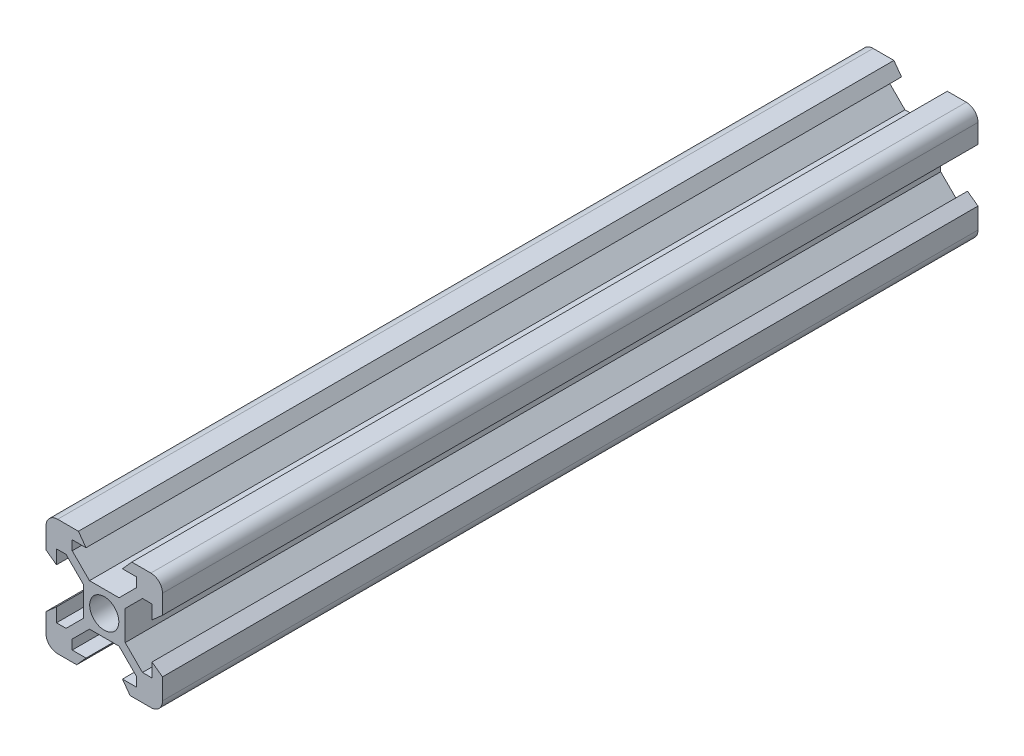
from build123d import *

# Parameters (mm, degrees)
SKETCH1_R           = 2.5
BOSS_EXTRUDE1_DEPTH = 140


with BuildPart() as part:
    # Sketch1 → Boss-Extrude1 (new body)
    with BuildSketch(Plane.XY):
        with BuildLine():
            Line((-4.725542729, -10), (-3.125, -8.2))
            Line((-3.125, -8.2), (-5.5, -8.2))
            Line((-5.5, -8.2), (-5.5, -6.560660172))
            Line((-5.5, -6.560660172), (-2.539339828, -3.6))
            Line((-2.539339828, -3.6), (2.539339828, -3.6))
            Line((2.539339828, -3.6), (5.5, -6.560660172))
            Line((5.5, -6.560660172), (5.5, -8.2))
            Line((5.5, -8.2), (3.125, -8.2))
            Line((3.125, -8.2), (4.434457271, -10))
            Line((4.434457271, -10), (8, -10))
            ThreePointArc((8, -10), (9.414213562, -9.414213562), (10, -8))
            Line((10, -8), (10, -4.434457271))
            Line((10, -4.434457271), (8.2, -3.125))
            Line((8.2, -3.125), (8.2, -5.5))
            Line((8.2, -5.5), (6.560660172, -5.5))
            Line((6.560660172, -5.5), (3.6, -2.539339828))
            Line((3.6, -2.539339828), (3.6, 2.539339828))
            Line((3.6, 2.539339828), (6.560660172, 5.5))
            Line((6.560660172, 5.5), (8.2, 5.5))
            Line((8.2, 5.5), (8.2, 3.125))
            Line((8.2, 3.125), (10, 4.725542729))
            Line((10, 4.725542729), (10, 8))
            ThreePointArc((10, 8), (9.414213562, 9.414213562), (8, 10))
            Line((8, 10), (4.725542729, 10))
            Line((4.725542729, 10), (3.125, 8.2))
            Line((3.125, 8.2), (5.5, 8.2))
            Line((5.5, 8.2), (5.5, 6.560660172))
            Line((5.5, 6.560660172), (2.539339828, 3.6))
            Line((2.539339828, 3.6), (-2.539339828, 3.6))
            Line((-2.539339828, 3.6), (-5.5, 6.560660172))
            Line((-5.5, 6.560660172), (-5.5, 8.2))
            Line((-5.5, 8.2), (-3.125, 8.2))
            Line((-3.125, 8.2), (-4.434457271, 10))
            Line((-4.434457271, 10), (-8, 10))
            ThreePointArc((-8, 10), (-9.414213562, 9.414213562), (-10, 8))
            Line((-10, 8), (-10, 4.434457271))
            Line((-10, 4.434457271), (-8.2, 3.125))
            Line((-8.2, 3.125), (-8.2, 5.5))
            Line((-8.2, 5.5), (-6.560660172, 5.5))
            Line((-6.560660172, 5.5), (-3.6, 2.539339828))
            Line((-3.6, 2.539339828), (-3.6, -2.539339828))
            Line((-3.6, -2.539339828), (-6.560660172, -5.5))
            Line((-6.560660172, -5.5), (-8.2, -5.5))
            Line((-8.2, -5.5), (-8.2, -3.125))
            Line((-8.2, -3.125), (-10, -4.725542729))
            Line((-10, -4.725542729), (-10, -8))
            ThreePointArc((-10, -8), (-9.414213562, -9.414213562), (-8, -10))
            Line((-8, -10), (-4.725542729, -10))
        make_face()
        Circle(SKETCH1_R, mode=Mode.SUBTRACT)
    extrude(amount=BOSS_EXTRUDE1_DEPTH)


solid = part.part
